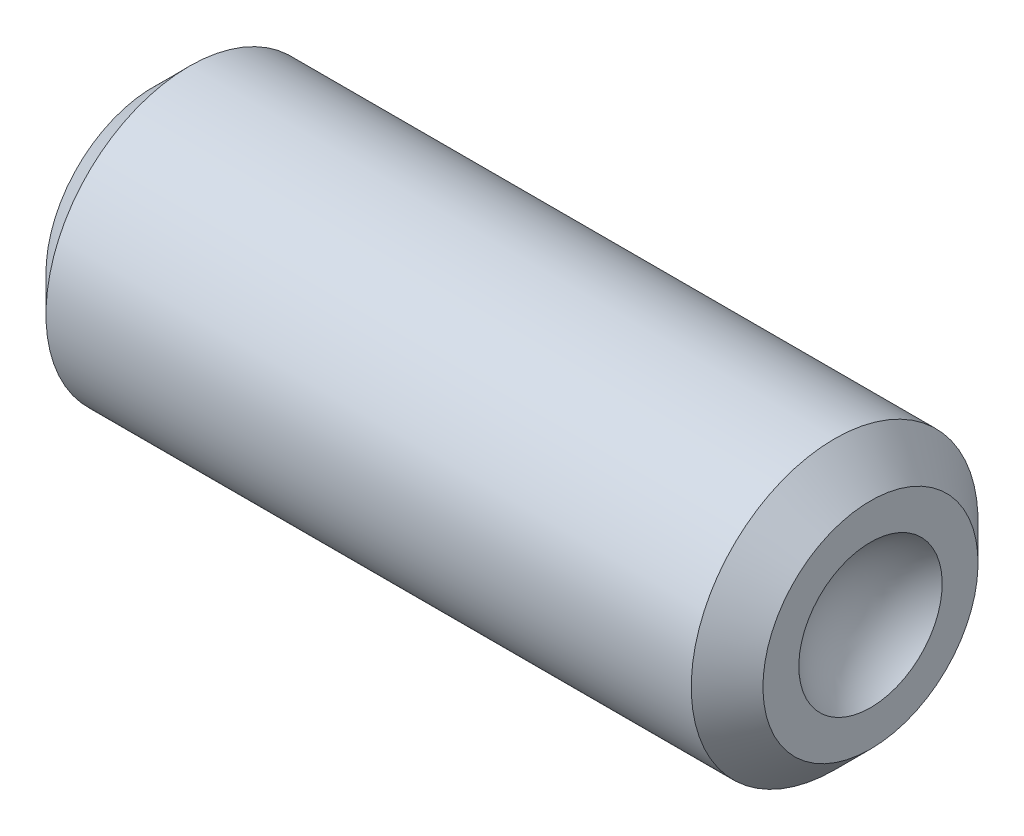
from build123d import *

# Parameters (mm, degrees)
CUT_EXTRUDE1_DEPTH = 8


with BuildPart() as part:
    # Sketch1 → Revolve1 (revolve)
    with BuildSketch(Plane.XY, mode=Mode.PRIVATE) as revolve1_sk:
        with BuildLine():
            Line((0, 0), (0, 1.5))
            Line((0, 1.5), (0.5, 2))
            Line((0.5, 2), (9.5, 2))
            Line((9.5, 2), (10, 1.5))
            Line((10, 1.5), (10, 1))
            ThreePointArc((10, 1), (9.631966011, 0.559016994), (9.5, 0))
            Line((9.5, 0), (0, 0))
        make_face()
    revolve(revolve1_sk.sketch.rotate(Axis((0, 0, 0), (1, 0, 0)), 180), axis=Axis((0, 0, 0), (1, 0, 0)))

    # Sketch2 → Cut-Extrude1 (cut)
    with BuildSketch(Plane.ZY):
        Polygon((0, 1.154700538), (-1, 0.577350269), (-1, -0.577350269), (0, -1.154700538), (1, -0.577350269), (1, 0.577350269), align=None)
    extrude(amount=-CUT_EXTRUDE1_DEPTH, mode=Mode.SUBTRACT)


solid = part.part
